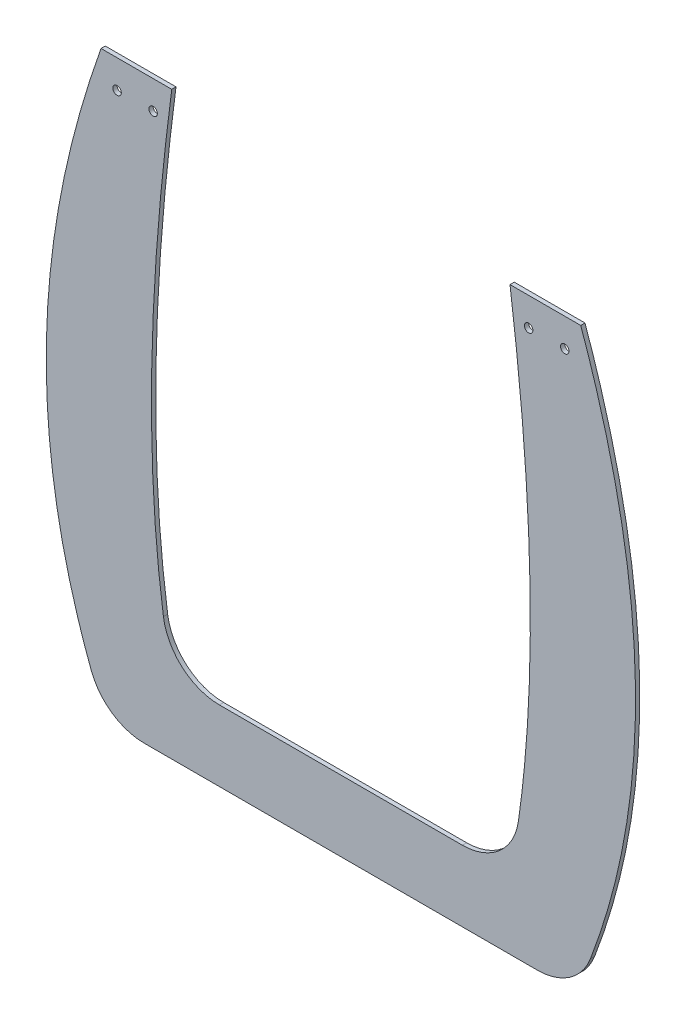
from build123d import *

# Parameters (mm, degrees)
SKETCH1_R           = 1.5
BOSS_EXTRUDE1_DEPTH = 1.5
FILLET1_R           = 20
FILLET2_R           = 20


with BuildPart() as part:
    # Sketch1 → Boss-Extrude1 (new body)
    with BuildSketch(Plane.XY):
        with BuildLine():
            Line((-4.311554675, 0), (20.688445325, 0))
            add(Edge.make_bspline(
                [(20.688445325, 0), (60.31282649, -111.601969695), (18.819240624, -205)],
                knots=[0, 0, 0, 0.94797239, 0.94797239, 0.94797239], degree=2))
            Line((18.819240624, -205), (-146.979240624, -205))
            add(Edge.make_bspline(
                [(-148.848445325, 0), (-188.47282649, -111.601969695), (-146.979240624, -205)],
                knots=[0, 0, 0, 0.94797239, 0.94797239, 0.94797239], degree=2))
            Line((-148.848445325, 0), (-123.848445325, 0))
            add(Edge.make_bspline(
                [(-123.848445325, 0), (-138.20220228, -108.592832155), (-123.848445325, -180)],
                knots=[0, 0, 0, 0.806546207, 0.806546207, 0.806546207], degree=2))
            Line((-123.848445325, -180), (-4.311554675, -180))
            add(Edge.make_bspline(
                [(-4.311554675, 0), (10.04220228, -108.592832155), (-4.311554675, -180)],
                knots=[0, 0, 0, 0.806546207, 0.806546207, 0.806546207], degree=2))
        make_face()
        with Locations((2.285, -10)):
            Circle(SKETCH1_R, mode=Mode.SUBTRACT)
        with Locations((15.025, -10)):
            Circle(SKETCH1_R, mode=Mode.SUBTRACT)
        with Locations(Location((-143.185, -10, 0), (0, 0, 180))):
            Circle(SKETCH1_R, mode=Mode.SUBTRACT)
        with Locations(Location((-130.445, -10, 0), (0, 0, 180))):
            Circle(SKETCH1_R, mode=Mode.SUBTRACT)
    extrude(amount=BOSS_EXTRUDE1_DEPTH)

    # Fillet1
    fillet1_edges = [part.edges().sort_by_distance(p)[0] for p in [
        (-123.848445325, -180, 0.75),
        (-4.311554675, -180, 0.75),
    ]]
    fillet(fillet1_edges, radius=FILLET1_R)

    # Fillet2
    fillet2_edges = [part.edges().sort_by_distance(p)[0] for p in [
        (-146.979240624, -205, 0.75),
        (18.819240624, -205, 0.75),
    ]]
    fillet(fillet2_edges, radius=FILLET2_R)


solid = part.part
